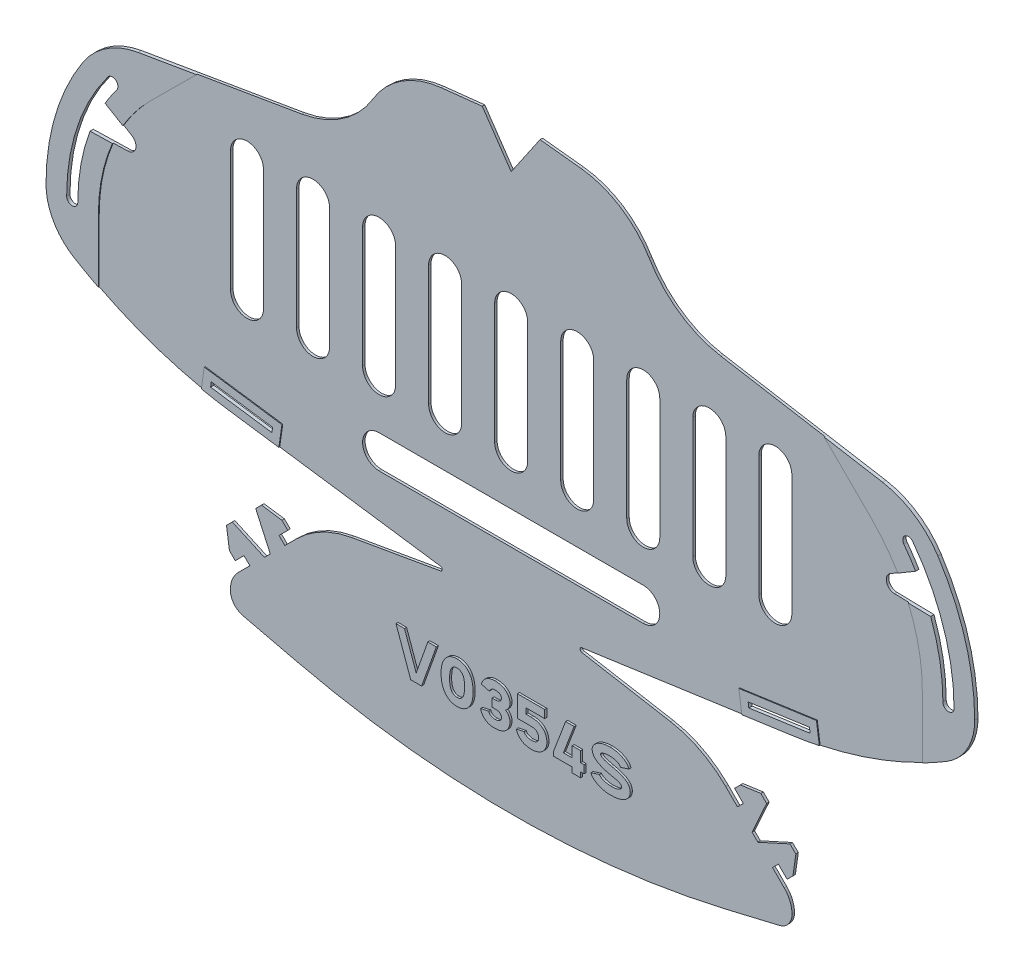
from build123d import *

# Parameters (mm, degrees)
MAIN_SHAPE_DEPTH                   = 0.6
ELASTIC_ATTACHMENT_POINTS_DEPTH    = 184.525502315
REINFORCED_ATTACHMENT_POINTS_DEPTH = 0.2
TAB_SLITS_DEPTH                    = 184.525502315
REINFORCED_TAB_SLITS_DEPTH         = 0.2
TAB_FLEX_RELIEF_DEPTH              = 184.525502315
TAB_FLEX_RELIEF_DEPTH_BACK         = 184.525502315
BREATHING_SLITS_DEPTH              = 184.525502315
VERSION_NUMBER_DEPTH               = 0.5
FILLET1_R                          = 0.5
CUT_EXTRUDE1_DEPTH                 = 184.526265229
CUT_EXTRUDE1_DEPTH_BACK            = 184.526265229


with BuildPart() as part:
    # Sketch1 → Main Shape (new body)
    with BuildSketch(Plane.XY):
        with BuildLine():
            Line((0, -10.235233266), (-7, 0))
            Line((-7, 0), (-16.941855461, -1.076805455))
            ThreePointArc((-16.941855461, -1.076805455), (-26.448172688, -4.42923559), (-33.461443341, -11.669600897))
            ThreePointArc((-33.461443341, -11.669600897), (-40.804108255, -19.481824954), (-50.74391922, -23.5))
            Line((-50.74391922, -23.5), (-90.180351554, -30.190874742))
            ThreePointArc((-90.180351554, -30.190874742), (-97.811505455, -33.190405434), (-103.597722286, -39))
            ThreePointArc((-103.597722286, -39), (-110.227482046, -53.35351039), (-112.5, -69))
            ThreePointArc((-112.5, -69), (-110.685143325, -75.893640703), (-105.711102551, -81))
            ThreePointArc((-105.711102551, -81), (-87.655491519, -89.524485559), (-68.266232563, -94.291935705))
            Line((-68.266232563, -94.291935705), (-14, -102))
            Line((-14, -102), (-38.626554922, -106.304973016))
            ThreePointArc((-38.626554922, -106.304973016), (-45.849449199, -108.748014338), (-52, -113.254607005))
            Line((-52, -113.254607005), (-54.828307349, -116.0831539))
            Line((-54.828307349, -116.0831539), (-56.242580797, -114.669000226))
            Line((-56.242580797, -114.669000226), (-54.121350285, -112.547590054))
            Line((-54.121350285, -112.547590054), (-55.535623732, -111.13343638))
            Line((-55.535623732, -111.13343638), (-60.48540114, -110.426539202))
            Line((-60.48540114, -110.426539202), (-68.970323187, -118.912179887))
            Line((-68.970323187, -118.912179887), (-68.263006804, -123.861897408))
            Line((-68.263006804, -123.861897408), (-66.848733357, -125.276051082))
            Line((-66.848733357, -125.276051082), (-64.727502845, -123.154640911))
            Line((-64.727502845, -123.154640911), (-63.313229397, -124.568794586))
            Line((-63.313229397, -124.568794586), (-66.141536747, -127.397341481))
            ThreePointArc((-66.141536747, -127.397341481), (-67.550417669, -129.506025763), (-68.045148042, -131.993340924))
            ThreePointArc((-68.045148042, -131.993340924), (-67.183295285, -134.473669911), (-64.9691321, -135.885159709))
            Line((-64.9691321, -135.885159709), (-52.436095294, -138.860716087))
            ThreePointArc((-52.436095294, -138.860716087), (-26.397134772, -143.459954927), (0, -145))
            ThreePointArc((0, -145), (26.397134772, -143.459954927), (52.436095294, -138.860716087))
            Line((52.436095294, -138.860716087), (64.9691321, -135.885159709))
            ThreePointArc((64.9691321, -135.885159709), (67.183295285, -134.473669911), (68.045148042, -131.993340924))
            ThreePointArc((68.045148042, -131.993340924), (67.550417669, -129.506025763), (66.141536747, -127.397341481))
            Line((66.141536747, -127.397341481), (63.313229397, -124.568794586))
            Line((63.313229397, -124.568794586), (64.727502845, -123.154640911))
            Line((64.727502845, -123.154640911), (66.848733357, -125.276051082))
            Line((66.848733357, -125.276051082), (68.263006804, -123.861897408))
            Line((68.263006804, -123.861897408), (68.970323187, -118.912179887))
            Line((68.970323187, -118.912179887), (60.48540114, -110.426539202))
            Line((60.48540114, -110.426539202), (55.535623732, -111.13343638))
            Line((55.535623732, -111.13343638), (54.121350285, -112.547590054))
            Line((54.121350285, -112.547590054), (56.242580797, -114.669000226))
            Line((56.242580797, -114.669000226), (54.828307349, -116.0831539))
            Line((54.828307349, -116.0831539), (52, -113.254607005))
            ThreePointArc((52, -113.254607005), (45.849449199, -108.748014338), (38.626554922, -106.304973016))
            Line((38.626554922, -106.304973016), (14, -102))
            Line((14, -102), (68.266232563, -94.291935705))
            ThreePointArc((68.266232563, -94.291935705), (87.655491519, -89.524485559), (105.711102551, -81))
            ThreePointArc((105.711102551, -81), (110.685143325, -75.893640703), (112.5, -69))
            ThreePointArc((112.5, -69), (110.227482046, -53.35351039), (103.597722286, -39))
            ThreePointArc((103.597722286, -39), (97.811505455, -33.190405434), (90.180351554, -30.190874742))
            Line((90.180351554, -30.190874742), (50.74391922, -23.5))
            ThreePointArc((50.74391922, -23.5), (40.804108255, -19.481824954), (33.461443341, -11.669600897))
            ThreePointArc((33.461443341, -11.669600897), (26.448172688, -4.42923559), (16.941855461, -1.076805455))
            Line((16.941855461, -1.076805455), (7, 0))
            Line((7, 0), (0, -10.235233266))
        make_face()
    extrude(amount=MAIN_SHAPE_DEPTH)

    # Sketch2 → Elastic Attachment Points (cut, through all)
    with BuildSketch(Plane.XY.offset(0.6)):
        with BuildLine():
            ThreePointArc((-97.5, -39), (-104.934164903, -53.188611699), (-107.5, -69))
            ThreePointArc((-107.5, -69), (-106.15, -70.35), (-104.8, -69))
            ThreePointArc((-104.8, -69), (-102.372719998, -54.042426667), (-95.34, -40.62))
            ThreePointArc((-95.34, -40.62), (-95.61, -38.73), (-97.5, -39))
        make_face()
        with BuildLine():
            ThreePointArc((97.5, -39), (104.934164903, -53.188611699), (107.5, -69))
            ThreePointArc((107.5, -69), (106.15, -70.35), (104.8, -69))
            ThreePointArc((104.8, -69), (102.372719998, -54.042426667), (95.34, -40.62))
            ThreePointArc((95.34, -40.62), (95.61, -38.73), (97.5, -39))
        make_face()
    extrude(amount=-ELASTIC_ATTACHMENT_POINTS_DEPTH, mode=Mode.SUBTRACT)

    # Sketch7 → Reinforced Attachment Points (add)
    # profile 1 of 2: a face of its own
    with BuildSketch(Plane.XY.offset(0.6)):
        with BuildLine():
            Line((-99.8, -69), (-99.8, -84.285345235))
            ThreePointArc((-99.8, -84.285345235), (-102.78333163, -82.692655957), (-105.711102551, -81))
            ThreePointArc((-105.711102551, -81), (-110.685143325, -75.893640703), (-112.5, -69))
            ThreePointArc((-112.5, -69), (-110.227482046, -53.35351039), (-103.597722286, -39))
            ThreePointArc((-103.597722286, -39), (-97.811505455, -33.190405434), (-90.180351554, -30.190874742))
            Line((-90.180351554, -30.190874742), (-76.046591346, -27.792908862))
            Line((-76.046591346, -27.792908862), (-87.320965779, -39))
            ThreePointArc((-87.320965779, -39), (-96.555837288, -52.754028999), (-99.8, -69))
        make_face()
        with BuildLine():
            ThreePointArc((-107.5, -69), (-106.15, -70.35), (-104.8, -69))
            ThreePointArc((-104.8, -69), (-102.372719998, -54.042426667), (-95.34, -40.62))
            ThreePointArc((-95.34, -40.62), (-95.61, -38.73), (-97.5, -39))
            ThreePointArc((-97.5, -39), (-104.934164903, -53.188611699), (-107.5, -69))
        make_face(mode=Mode.SUBTRACT)
    # profile 2 of 2: a face of its own
    with BuildSketch(Plane.XY.offset(0.6)):
        with BuildLine():
            Line((76.046591346, -27.792908862), (90.180351554, -30.190874742))
            ThreePointArc((90.180351554, -30.190874742), (97.811505455, -33.190405434), (103.597722286, -39))
            ThreePointArc((103.597722286, -39), (110.227482046, -53.35351039), (112.5, -69))
            ThreePointArc((112.5, -69), (110.685143325, -75.893640703), (105.711102551, -81))
            ThreePointArc((105.711102551, -81), (102.78333163, -82.692655957), (99.8, -84.285345235))
            Line((99.8, -84.285345235), (99.8, -69))
            ThreePointArc((99.8, -69), (96.555837288, -52.754028999), (87.320965779, -39))
            Line((87.320965779, -39), (76.046591346, -27.792908862))
        make_face()
        with BuildLine():
            ThreePointArc((104.8, -69), (106.15, -70.35), (107.5, -69))
            ThreePointArc((107.5, -69), (104.934164903, -53.188611699), (97.5, -39))
            ThreePointArc((97.5, -39), (95.61, -38.73), (95.34, -40.62))
            ThreePointArc((95.34, -40.62), (102.372719998, -54.042426667), (104.8, -69))
        make_face(mode=Mode.SUBTRACT)
    extrude(amount=REINFORCED_ATTACHMENT_POINTS_DEPTH)

    # Sketch6 → Tab Slits (cut, through all)
    with BuildSketch(Plane.XY.offset(0.6)):
        Polygon((-72.627441637, -91.652387373), (-57.776508424, -93.761838179), (-57.60775236, -92.573763522), (-72.458685573, -90.464312716), align=None)
        Polygon((72.627441637, -91.652387373), (72.458685573, -90.464312716), (57.60775236, -92.573763522), (57.776508424, -93.761838179), align=None)
    extrude(amount=-TAB_SLITS_DEPTH, mode=Mode.SUBTRACT)

    # Sketch9 → Reinforced Tab Slits (add)
    # profile 1 of 2: a face of its own
    with BuildSketch(Plane.XY.offset(0.6)):
        with BuildLine():
            Line((-56.077644103, -96.023222715), (-55.346367824, -90.874899201))
            Line((-55.346367824, -90.874899201), (-74.157549894, -88.20292818))
            Line((-74.157549894, -88.20292818), (-74.857329404, -93.129508476))
            ThreePointArc((-74.857329404, -93.129508476), (-71.571508598, -93.76587879), (-68.266232563, -94.291935705))
            Line((-68.266232563, -94.291935705), (-56.077644103, -96.023222715))
        make_face()
        Polygon((-57.776508424, -93.761838179), (-57.60775236, -92.573763522), (-72.458685573, -90.464312716), (-72.627441637, -91.652387373), align=None, mode=Mode.SUBTRACT)
    # profile 2 of 2: a face of its own
    with BuildSketch(Plane.XY.offset(0.6)):
        with BuildLine():
            Line((68.266232563, -94.291935705), (56.077644103, -96.023222715))
            Line((56.077644103, -96.023222715), (55.346367824, -90.874899201))
            Line((55.346367824, -90.874899201), (74.157549894, -88.20292818))
            Line((74.157549894, -88.20292818), (74.857329404, -93.129508476))
            ThreePointArc((74.857329404, -93.129508476), (71.571508598, -93.76587879), (68.266232563, -94.291935705))
        make_face()
        Polygon((57.60775236, -92.573763522), (72.458685573, -90.464312716), (72.627441637, -91.652387373), (57.776508424, -93.761838179), align=None, mode=Mode.SUBTRACT)
    extrude(amount=REINFORCED_TAB_SLITS_DEPTH)

    # Sketch11 → Tab Flex Relief (cut, two sides: drawn at the far end of the back side and taken through both)
    with BuildSketch(Plane.XY.offset(0.6).offset(-TAB_FLEX_RELIEF_DEPTH_BACK)):
        Polygon((-67.556169513, -117.49790644), (-59.777845211, -121.033110967), (-58.363691536, -119.618837519), (-61.899554814, -111.840812649), align=None)
        Polygon((61.899554814, -111.840812649), (67.556169513, -117.49790644), (59.777845211, -121.033110967), (58.363691536, -119.618837519), align=None)
    extrude(amount=TAB_FLEX_RELIEF_DEPTH + TAB_FLEX_RELIEF_DEPTH_BACK, mode=Mode.SUBTRACT)

    # Sketch3 → Breathing Slits (cut, through all)
    with BuildSketch(Plane.XY.offset(0.6)):
        with BuildLine():
            Line((4, -39.81), (4, -69))
            ThreePointArc((4, -69), (0, -73), (-4, -69))
            Line((-4, -69), (-4, -39.81))
            ThreePointArc((-4, -39.81), (0, -35.81), (4, -39.81))
        make_face()
        with BuildLine():
            Line((-12, -39.81), (-12, -69))
            ThreePointArc((-12, -69), (-16, -73), (-20, -69))
            Line((-20, -69), (-20, -39.81))
            ThreePointArc((-20, -39.81), (-16, -35.81), (-12, -39.81))
        make_face()
        with BuildLine():
            Line((-28, -39.81), (-28, -69))
            ThreePointArc((-28, -69), (-32, -73), (-36, -69))
            Line((-36, -69), (-36, -39.81))
            ThreePointArc((-36, -39.81), (-32, -35.81), (-28, -39.81))
        make_face()
        with BuildLine():
            Line((-32, -81), (32, -81))
            ThreePointArc((32, -81), (36, -85), (32, -89))
            Line((32, -89), (-32, -89))
            ThreePointArc((-32, -89), (-36, -85), (-32, -81))
        make_face()
        with BuildLine():
            Line((-44, -39.81), (-44, -69))
            ThreePointArc((-44, -69), (-48, -73), (-52, -69))
            Line((-52, -69), (-52, -39.81))
            ThreePointArc((-52, -39.81), (-48, -35.81), (-44, -39.81))
        make_face()
        with BuildLine():
            Line((-60, -39.81), (-60, -69))
            ThreePointArc((-60, -69), (-64, -73), (-68, -69))
            Line((-68, -69), (-68, -39.81))
            ThreePointArc((-68, -39.81), (-64, -35.81), (-60, -39.81))
        make_face()
        with BuildLine():
            Line((12, -39.81), (12, -69))
            ThreePointArc((12, -69), (16, -73), (20, -69))
            Line((20, -69), (20, -39.81))
            ThreePointArc((20, -39.81), (16, -35.81), (12, -39.81))
        make_face()
        with BuildLine():
            Line((28, -39.81), (28, -69))
            ThreePointArc((28, -69), (32, -73), (36, -69))
            Line((36, -69), (36, -39.81))
            ThreePointArc((36, -39.81), (32, -35.81), (28, -39.81))
        make_face()
        with BuildLine():
            Line((44, -39.81), (44, -69))
            ThreePointArc((44, -69), (48, -73), (52, -69))
            Line((52, -69), (52, -39.81))
            ThreePointArc((52, -39.81), (48, -35.81), (44, -39.81))
        make_face()
        with BuildLine():
            Line((60, -39.81), (60, -69))
            ThreePointArc((60, -69), (64, -73), (68, -69))
            Line((68, -69), (68, -39.81))
            ThreePointArc((68, -39.81), (64, -35.81), (60, -39.81))
        make_face()
    extrude(amount=-BREATHING_SLITS_DEPTH, mode=Mode.SUBTRACT)

    # Sketch8 → Version Number (add)
    # profile 1 of 6: a face of its own
    with BuildSketch(Plane.XY.offset(0.6)):
        Polygon((-23.832604493, -128.5), (-21.197683858, -128.5), (-17.626255287, -118.5), (-19.68974735, -118.5), (-22.515144176, -126.420634921), (-25.340541001, -118.5), (-27.404033065, -118.5), align=None)
    # profile 2 of 6: a face of its own
    with BuildSketch(Plane.XY.offset(0.6)):
        with BuildLine():
            add(Edge.make_bspline(
                [(-12.604080607, -118.5), (-12.748446571, -118.505695671), (-13.031201719, -118.51685121), (-13.44433672, -118.5745591), (-13.832179423, -118.680335178), (-14.199380999, -118.819656178), (-14.54165657, -119.003303471), (-14.865449745, -119.221085059), (-15.15846036, -119.487440084), (-15.433915413, -119.785519386), (-15.679778594, -120.12453761), (-15.893214303, -120.500892889), (-16.07517708, -120.912503383), (-16.224098244, -121.360169436), (-16.339647292, -121.844506854), (-16.427401231, -122.364485904), (-16.47895567, -122.921030718), (-16.4896124, -123.303893775), (-16.495090982, -123.500722112)],
                knots=[0, 0, 0, 0, 0.970159994, 1.900155169, 2.79438565, 3.665191596, 4.532301255, 5.397946305, 6.279238358, 7.185391655, 8.120220805, 9.085107467, 10.08639026, 11.138349125, 12.249459105, 13.427760297, 14.677622047, 16, 16, 16, 16], degree=3))
            add(Edge.make_bspline(
                [(-16.495090982, -123.500722112), (-16.489667591, -123.69832053), (-16.479158964, -124.081196856), (-16.427191895, -124.637697099), (-16.339746005, -125.156966907), (-16.223636148, -125.641884177), (-16.075693485, -126.090648826), (-15.89314686, -126.502814664), (-15.679836556, -126.879260377), (-15.433755376, -127.218032326), (-15.159363638, -127.51659595), (-14.863896092, -127.779877259), (-14.542544849, -128.000979952), (-14.199187545, -128.183632701), (-13.83263449, -128.324409639), (-13.443681411, -128.425104033), (-13.03190309, -128.488808035), (-12.749121717, -128.496221224), (-12.604977641, -128.5)],
                knots=[0, 0, 0, 0, 1.327400251, 2.57203543, 3.750234214, 4.861247624, 5.917991082, 6.919186852, 7.883989653, 8.818737555, 9.724812096, 10.602616666, 11.47109776, 12.338132057, 13.208862319, 14.101698703, 15.032365954, 16, 16, 16, 16], degree=3))
            add(Edge.make_bspline(
                [(-12.604977641, -128.5), (-12.460837973, -128.496210687), (-12.178065243, -128.488776824), (-11.766224829, -128.425221319), (-11.376802498, -128.323813307), (-11.00944102, -128.184839888), (-10.667051541, -128.000200623), (-10.346005134, -127.779984633), (-10.050606466, -127.516566079), (-9.776196666, -127.218040576), (-9.530116039, -126.879258594), (-9.316823297, -126.502813072), (-9.13420142, -126.090657611), (-8.986563682, -125.641847927), (-8.869250832, -125.157235462), (-8.786808686, -124.637275213), (-8.72915246, -124.081441513), (-8.721242092, -123.698369528), (-8.717160708, -123.500722112)],
                knots=[0, 0, 0, 0, 0.96765053, 1.898333634, 2.791185227, 3.666728435, 4.529238626, 5.397734515, 6.275554038, 7.181644014, 8.116407839, 9.081227075, 10.082439899, 11.139201358, 12.250233695, 13.427610983, 14.672766316, 16, 16, 16, 16], degree=3))
            add(Edge.make_bspline(
                [(-8.717160708, -123.500722112), (-8.721301538, -123.303845261), (-8.729358243, -122.920787111), (-8.786602221, -122.364907693), (-8.869350416, -121.844238468), (-8.986100052, -121.360205444), (-9.134718017, -120.912494629), (-9.316755834, -120.500894477), (-9.530174011, -120.124539393), (-9.776036606, -119.785511139), (-10.051509843, -119.487469991), (-10.344451051, -119.220977415), (-10.667935913, -119.004075275), (-11.009247561, -118.818455332), (-11.377258125, -118.680915067), (-11.765574757, -118.574534625), (-12.178423835, -118.516562336), (-12.460908666, -118.506550382), (-12.604977641, -118.501444225)],
                knots=[0, 0, 0, 0, 1.322391154, 2.572941942, 3.750582404, 4.861863084, 5.913983562, 6.915420183, 7.880455081, 8.815427849, 9.721720359, 10.603147806, 11.468925845, 12.331628829, 13.207367743, 14.101735605, 15.031873656, 16, 16, 16, 16], degree=3))
            Line((-12.604977641, -118.501444225), (-12.604080607, -118.5))
        make_face()
        with BuildLine():
            add(Edge.make_bspline(
                [(-12.604080607, -126.579365079), (-12.673400155, -126.580142247), (-12.809410481, -126.581667111), (-13.006863718, -126.549518886), (-13.193314813, -126.50001124), (-13.367492108, -126.424863461), (-13.531287469, -126.32888552), (-13.681903012, -126.207295998), (-13.820262035, -126.063513987), (-13.947577093, -125.896932623), (-14.061448396, -125.703005633), (-14.159979385, -125.478827118), (-14.2407168, -125.222713054), (-14.309893558, -124.937433189), (-14.361144923, -124.621763618), (-14.399648488, -124.276117752), (-14.425515152, -123.899148475), (-14.428874427, -123.63702081), (-14.430621151, -123.500722112)],
                knots=[0, 0, 0, 0, 0.820209436, 1.609314487, 2.362064528, 3.101854642, 3.850272983, 4.605479342, 5.3882482, 6.210255141, 7.084711649, 8.047345167, 9.106040688, 10.263495908, 11.523832392, 12.893430008, 14.384674726, 16, 16, 16, 16], degree=3))
            add(Edge.make_bspline(
                [(-14.430621151, -123.500722112), (-14.42886754, -123.364424703), (-14.425495021, -123.102299516), (-14.399719376, -122.725313211), (-14.360826402, -122.378974061), (-14.310530118, -122.063111109), (-14.240312695, -121.778059679), (-14.160009663, -121.522619394), (-14.061479503, -121.298401339), (-13.947444844, -121.104640769), (-13.82105454, -120.937923887), (-13.681092054, -120.796456824), (-13.531371302, -120.674830172), (-13.367531418, -120.578630118), (-13.192885398, -120.50465551), (-13.007517851, -120.450210023), (-12.809374142, -120.423926373), (-12.67393087, -120.422146526), (-12.604977641, -120.421240419)],
                knots=[0, 0, 0, 0, 1.616177311, 3.108208617, 4.478528655, 5.748482895, 6.897727805, 7.956981757, 8.920123036, 9.795040793, 10.617481319, 11.394165711, 12.149770419, 12.898583529, 13.63876386, 14.394368568, 15.182584207, 16, 16, 16, 16], degree=3))
            add(Edge.make_bspline(
                [(-12.604977641, -120.421240419), (-12.536026006, -120.422149219), (-12.400585862, -120.423934355), (-12.202419641, -120.450179948), (-12.017133054, -120.504762296), (-11.842799707, -120.577982734), (-11.680574372, -120.675595023), (-11.531104614, -120.796360516), (-11.391204367, -120.937948802), (-11.264840055, -121.104645093), (-11.150615318, -121.298351736), (-11.052830037, -121.523063414), (-10.968870179, -121.777554553), (-10.89968108, -122.063195246), (-10.849051401, -122.378948588), (-10.810259287, -122.725320897), (-10.784453623, -123.102297333), (-10.781085472, -123.364423957), (-10.779334132, -123.500722112)],
                knots=[0, 0, 0, 0, 0.817669415, 1.606129616, 2.361968767, 3.102378757, 3.843623451, 4.599462602, 5.376387978, 6.199083685, 7.074272906, 8.037713021, 9.100132017, 10.249733507, 11.520081779, 12.89082699, 14.383321233, 16, 16, 16, 16], degree=3))
            add(Edge.make_bspline(
                [(-10.779334132, -123.500722112), (-10.781078585, -123.637021556), (-10.784433493, -123.899150658), (-10.810330169, -124.276110066), (-10.848733119, -124.621789015), (-10.900316338, -124.937349474), (-10.968458203, -125.223220708), (-11.052859715, -125.478383327), (-11.15064657, -125.703055181), (-11.264707749, -125.896928348), (-11.391996891, -126.063488884), (-11.530292982, -126.207393621), (-11.680657071, -126.328120602), (-11.842838298, -126.425517476), (-12.016703548, -126.499891817), (-12.203072886, -126.549600883), (-12.400262515, -126.581404352), (-12.53596105, -126.580608552), (-12.604977641, -126.580203806)],
                knots=[0, 0, 0, 0, 1.616177474, 3.108208932, 4.478529109, 5.739530511, 6.897596372, 7.959685938, 8.922827315, 9.797745161, 10.620185771, 11.403367596, 12.15897238, 12.899987232, 13.640167639, 14.39331481, 15.182836171, 16, 16, 16, 16], degree=3))
            Line((-12.604977641, -126.580203806), (-12.604080607, -126.579365079))
        make_face(mode=Mode.SUBTRACT)
    # profile 3 of 6: a face of its own
    with BuildSketch(Plane.XY.offset(0.6)):
        with BuildLine():
            Line((-3.2814758, -124.404761905), (-3.186237705, -124.404761905))
            add(Edge.make_bspline(
                [(-3.186237705, -124.404761905), (-3.08596981, -124.411299477), (-2.895334608, -124.423729091), (-2.628668312, -124.486416557), (-2.395874223, -124.578961335), (-2.204186845, -124.709274647), (-2.050541544, -124.861365804), (-1.936214105, -125.032278467), (-1.866552861, -125.222537651), (-1.857677424, -125.355662585), (-1.853200393, -125.422814713)],
                knots=[0, 0, 0, 0, 1.293250512, 2.458803691, 3.516087315, 4.504014474, 5.424976382, 6.287022232, 7.135923681, 8, 8, 8, 8], degree=3))
            add(Edge.make_bspline(
                [(-1.853200393, -125.422814713), (-1.856489943, -125.504440638), (-1.862850929, -125.662280257), (-1.931998301, -125.887718235), (-2.050353158, -126.087113891), (-2.185268995, -126.23073656), (-2.31443365, -126.331172702), (-2.429322646, -126.395688771), (-2.558173546, -126.450185226), (-2.701201552, -126.49595932), (-2.857923011, -126.532200484), (-3.028881948, -126.560253509), (-3.21470567, -126.575366879), (-3.343544666, -126.5785552), (-3.410164292, -126.580203806)],
                knots=[0, 0, 0, 0, 1.334208421, 2.579951764, 3.816761299, 5.103436918, 5.78324123, 6.491044783, 7.25516555, 8.072210043, 8.94833879, 9.888551629, 10.908219533, 12, 12, 12, 12], degree=3))
            add(Edge.make_bspline(
                [(-3.410164292, -126.580203806), (-3.484557883, -126.579024673), (-3.635042476, -126.576639503), (-3.861689022, -126.537785365), (-4.08996398, -126.472292557), (-4.317061379, -126.384048723), (-4.53121798, -126.26078738), (-4.708540508, -126.088542309), (-4.849710264, -125.87591894), (-4.904279418, -125.712337396), (-4.932682087, -125.62719493)],
                knots=[0, 0, 0, 0, 0.920255672, 1.861508472, 2.836752399, 3.857684402, 4.873720033, 5.872631744, 6.892727297, 8, 8, 8, 8], degree=3))
            Line((-4.932682087, -125.62719493), (-6.916396435, -126.071428571))
            add(Edge.make_bspline(
                [(-6.916396435, -126.071428571), (-6.893561151, -126.160336196), (-6.848605006, -126.335369884), (-6.755596127, -126.586847228), (-6.644158689, -126.824009097), (-6.519002346, -127.050933458), (-6.370851259, -127.26169635), (-6.20668272, -127.459934114), (-6.02745119, -127.647890635), (-5.827118898, -127.819546753), (-5.60967192, -127.976110236), (-5.372525346, -128.112422888), (-5.117959848, -128.230322428), (-4.842422458, -128.322934743), (-4.550304843, -128.399729339), (-4.239036274, -128.45295857), (-3.910205295, -128.491934936), (-3.684323803, -128.497268097), (-3.56861637, -128.5)],
                knots=[0, 0, 0, 0, 0.97897001, 1.927311989, 2.855460552, 3.773345826, 4.68872018, 5.599601379, 6.518067916, 7.456260856, 8.41049365, 9.372940738, 10.370680865, 11.39871829, 12.470472684, 13.590411754, 14.765692276, 16, 16, 16, 16], degree=3))
            add(Edge.make_bspline(
                [(-3.56861637, -128.5), (-3.412346484, -128.494245394), (-3.109820434, -128.483104934), (-2.672011645, -128.435865678), (-2.266363263, -128.358387224), (-1.892588471, -128.252017359), (-1.547714777, -128.123277608), (-1.236729357, -127.961059217), (-0.954637921, -127.774497038), (-0.7069839, -127.55815064), (-0.492589187, -127.319870658), (-0.300831613, -127.071551477), (-0.143042321, -126.805353082), (-0.010511667, -126.527874631), (0.088115957, -126.234513517), (0.15957966, -125.928607165), (0.201252062, -125.607680152), (0.206369695, -125.38925418), (0.208973031, -125.278141077)],
                knots=[0, 0, 0, 0, 1.338573179, 2.591371041, 3.766159492, 4.869841347, 5.915366975, 6.911991706, 7.866279139, 8.804635322, 9.718527085, 10.607232931, 11.486170613, 12.362759498, 13.235296616, 14.130311397, 15.048891017, 16, 16, 16, 16], degree=3))
            add(Edge.make_bspline(
                [(0.208973031, -125.278141077), (0.203624604, -125.181448476), (0.193097844, -124.991138356), (0.137782259, -124.713321084), (0.045422371, -124.451246621), (-0.083769367, -124.20784025), (-0.234969073, -123.977552327), (-0.410100489, -123.764837772), (-0.604497535, -123.566155092), (-0.748922201, -123.449574998), (-0.822113681, -123.39049458)],
                knots=[0, 0, 0, 0, 1.042147361, 2.051151675, 3.039496243, 4.024119517, 5.012016893, 6.002285516, 6.987598979, 8, 8, 8, 8], degree=3))
            add(Edge.make_bspline(
                [(-0.822113681, -123.39049458), (-0.748932646, -123.325162044), (-0.60457189, -123.19628365), (-0.410299767, -122.981710509), (-0.236129062, -122.755542958), (-0.08277331, -122.515248899), (0.044428215, -122.261642739), (0.137252304, -121.993228321), (0.193160567, -121.711764564), (0.203645955, -121.519933272), (0.208973031, -121.42247384)],
                knots=[0, 0, 0, 0, 1.026734164, 2.025389794, 3.025877614, 4.013273499, 5.006315215, 5.989929209, 6.978788314, 8, 8, 8, 8], degree=3))
            add(Edge.make_bspline(
                [(0.208973031, -121.42247384), (0.204891166, -121.322020203), (0.196872186, -121.124675201), (0.149929489, -120.835115028), (0.074751474, -120.558271626), (-0.032690583, -120.294880847), (-0.166106179, -120.042407113), (-0.330918093, -119.803370965), (-0.521947271, -119.574583887), (-0.74277813, -119.361344215), (-0.989477288, -119.166999953), (-1.261285504, -118.995833154), (-1.555824194, -118.84746887), (-1.876600247, -118.730513446), (-2.218515864, -118.632405283), (-2.5843957, -118.562780212), (-2.973470855, -118.515976725), (-3.240858946, -118.506371293), (-3.378014595, -118.501444225)],
                knots=[0, 0, 0, 0, 0.933249724, 1.833404674, 2.71837752, 3.592513965, 4.4704886, 5.365912677, 6.284554944, 7.234984132, 8.212272519, 9.196674926, 10.214289296, 11.269589965, 12.363543901, 13.515449053, 14.72555956, 16, 16, 16, 16], degree=3))
            add(Edge.make_bspline(
                [(-3.378014595, -118.501444225), (-3.491406947, -118.504384419), (-3.712587706, -118.510119502), (-4.035371976, -118.546209564), (-4.341201281, -118.597359567), (-4.630020007, -118.671164203), (-4.901063564, -118.76520159), (-5.154785647, -118.877770477), (-5.391315181, -119.009217236), (-5.60891845, -119.161041577), (-5.809179026, -119.328960798), (-5.990576014, -119.510905494), (-6.155323007, -119.704452098), (-6.299857183, -119.91288512), (-6.429486659, -120.132286581), (-6.536021688, -120.36651166), (-6.630940646, -120.610059019), (-6.674344864, -120.780460499), (-6.696322609, -120.866743363)],
                knots=[0, 0, 0, 0, 1.229240767, 2.397731417, 3.51786287, 4.588673614, 5.625367482, 6.624717489, 7.594406979, 8.554388623, 9.496885304, 10.424058211, 11.336820069, 12.248524965, 13.170856983, 14.095351914, 15.035580601, 16, 16, 16, 16], degree=3))
            Line((-6.696322609, -120.866743363), (-4.789412308, -121.373015873))
            add(Edge.make_bspline(
                [(-4.789412308, -121.373015873), (-4.778114658, -121.326631527), (-4.753598482, -121.22597637), (-4.663097355, -121.081457089), (-4.541248681, -120.927147787), (-4.380035906, -120.771324055), (-4.182658133, -120.625559671), (-3.944568155, -120.514206488), (-3.671483768, -120.446844288), (-3.47865433, -120.430020784), (-3.378014595, -120.421240419)],
                knots=[0, 0, 0, 0, 0.626586808, 1.359708585, 2.222843852, 3.223153095, 4.308434095, 5.447412619, 6.667777482, 8, 8, 8, 8], degree=3))
            add(Edge.make_bspline(
                [(-3.378014595, -120.421240419), (-3.305981609, -120.423218633), (-3.16774612, -120.42701494), (-2.970342798, -120.449676308), (-2.79005117, -120.474391788), (-2.629001765, -120.515621967), (-2.483386758, -120.558109891), (-2.358777571, -120.618078056), (-2.248016237, -120.680273756), (-2.133112549, -120.780934624), (-2.018784558, -120.912654377), (-1.915790606, -121.077310889), (-1.855793591, -121.24921056), (-1.854054523, -121.365405566), (-1.853200393, -121.42247384)],
                knots=[0, 0, 0, 0, 1.26888152, 2.435057415, 3.499383416, 4.470882074, 5.362320585, 6.164854387, 6.902680001, 7.591682225, 8.843898063, 9.963361673, 10.999720905, 12, 12, 12, 12], degree=3))
            add(Edge.make_bspline(
                [(-1.853200393, -121.42247384), (-1.858271147, -121.49199044), (-1.868349345, -121.630155711), (-1.943628158, -121.827940252), (-2.065153471, -122.008163808), (-2.228480217, -122.171288708), (-2.435816126, -122.307565764), (-2.683353101, -122.408872593), (-2.970233435, -122.47003825), (-3.174088278, -122.480300003), (-3.281565504, -122.485710249)],
                knots=[0, 0, 0, 0, 0.842573162, 1.674626639, 2.532888499, 3.465967991, 4.458251597, 5.524776888, 6.695002246, 8, 8, 8, 8], degree=3))
            Line((-3.281565504, -122.485710249), (-4.138618657, -122.484126984))
            Line((-4.138618657, -122.484126984), (-4.138618657, -124.404761905))
            Line((-4.138618657, -124.404761905), (-3.2814758, -124.404761905))
        make_face()
    # profile 4 of 6: a face of its own
    with BuildSketch(Plane.XY.offset(0.6)):
        with BuildLine():
            Line((5.366236539, -121.753968254), (4.080522253, -121.753968254))
            Line((4.080522253, -121.753968254), (4.080522253, -120.420634921))
            Line((4.080522253, -120.420634921), (8.620204793, -120.420634921))
            Line((8.620204793, -120.420634921), (8.620204793, -118.5))
            Line((8.620204793, -118.5), (2.01703019, -118.5))
            Line((2.01703019, -118.5), (2.01703019, -123.674603175))
            Line((2.01703019, -123.674603175), (5.28687146, -123.674603175))
            add(Edge.make_bspline(
                [(5.28687146, -123.674603175), (5.360960809, -123.675602086), (5.504912844, -123.677542922), (5.71435947, -123.692704514), (5.909877517, -123.723042675), (6.091401035, -123.763288516), (6.258501355, -123.817251662), (6.413089295, -123.879484934), (6.55070767, -123.959553064), (6.678087611, -124.046197885), (6.786971001, -124.149968295), (6.883114048, -124.26484275), (6.966137644, -124.390602025), (7.032499994, -124.530129867), (7.085487911, -124.680251755), (7.124394318, -124.842608973), (7.149739306, -125.017132432), (7.155130405, -125.137973815), (7.157900402, -125.200063241)],
                knots=[0, 0, 0, 0, 1.291340122, 2.50901164, 3.656233385, 4.737231688, 5.745647761, 6.71445312, 7.634539433, 8.515488686, 9.393300537, 10.245701923, 11.122702301, 12.011797026, 12.93168986, 13.892747604, 14.917274139, 16, 16, 16, 16], degree=3))
            add(Edge.make_bspline(
                [(7.157900402, -125.200063241), (7.153688052, -125.300114528), (7.14560378, -125.492131264), (7.065338201, -125.765733398), (6.926196706, -126.004538024), (6.767586314, -126.17434082), (6.615830139, -126.290319351), (6.484099394, -126.365431401), (6.338663975, -126.430026061), (6.178317613, -126.482096845), (6.004524143, -126.52675039), (5.814347501, -126.55439299), (5.610647927, -126.576932347), (5.469348079, -126.5790915), (5.396556287, -126.580203806)],
                knots=[0, 0, 0, 0, 1.417186054, 2.719839454, 3.999831516, 5.306419273, 5.988605249, 6.704054952, 7.452945314, 8.243009127, 9.093975494, 9.995834141, 10.967537284, 12, 12, 12, 12], degree=3))
            add(Edge.make_bspline(
                [(5.396556287, -126.580203806), (5.287648259, -126.574841975), (5.076983951, -126.564470411), (4.772033735, -126.511605126), (4.490160726, -126.424404763), (4.235903487, -126.306180725), (4.014818092, -126.167710506), (3.84297428, -126.007163051), (3.711326814, -125.83604344), (3.67087374, -125.706158133), (3.651287019, -125.643269778)],
                knots=[0, 0, 0, 0, 1.239808568, 2.398201666, 3.511107812, 4.586578273, 5.581900341, 6.46310827, 7.255862013, 8, 8, 8, 8], degree=3))
            Line((3.651287019, -125.643269778), (1.731315904, -126.071428571))
            add(Edge.make_bspline(
                [(1.731315904, -126.071428571), (1.755385764, -126.160548359), (1.803016248, -126.336902466), (1.909090395, -126.587616399), (2.033649421, -126.825640703), (2.178153898, -127.052018478), (2.346933994, -127.263372267), (2.536768461, -127.462365132), (2.748253619, -127.648069148), (2.980261942, -127.81997371), (3.229432639, -127.975914274), (3.495680822, -128.111508549), (3.775180047, -128.229596507), (4.071741517, -128.322648571), (4.381439946, -128.399168227), (4.707064689, -128.452814481), (5.046589519, -128.491742739), (5.278559699, -128.49721594), (5.396556287, -128.5)],
                knots=[0, 0, 0, 0, 0.933358014, 1.846969395, 2.747978179, 3.65058438, 4.560476191, 5.481090533, 6.430749403, 7.405393302, 8.400725728, 9.402100456, 10.426556211, 11.46786461, 12.544569044, 13.652675183, 14.805983081, 16, 16, 16, 16], degree=3))
            add(Edge.make_bspline(
                [(5.396556287, -128.5), (5.53376265, -128.495504774), (5.80219759, -128.486710171), (6.193287593, -128.433418982), (6.56517222, -128.360336182), (6.914706315, -128.252803179), (7.246000147, -128.123435212), (7.553843956, -127.960769192), (7.843937541, -127.774871052), (8.109204433, -127.558743904), (8.348569717, -127.321416343), (8.561177645, -127.067668109), (8.736441803, -126.794179288), (8.889676891, -126.509027952), (9.002782919, -126.203081966), (9.088391885, -125.88344012), (9.142028955, -125.5470022), (9.152646735, -125.31737072), (9.158070839, -125.200063241)],
                knots=[0, 0, 0, 0, 1.17826532, 2.30519616, 3.385644728, 4.42967802, 5.441717964, 6.435616201, 7.414838536, 8.396397341, 9.367976222, 10.306520034, 11.232826888, 12.153236024, 13.081197769, 14.026829533, 14.992003824, 16, 16, 16, 16], degree=3))
            add(Edge.make_bspline(
                [(9.158070839, -125.200063241), (9.153929994, -125.073635127), (9.145821892, -124.826078875), (9.100298755, -124.463686468), (9.02222004, -124.120728156), (8.914237738, -123.797399283), (8.77588151, -123.493469509), (8.604899259, -123.211065096), (8.405886833, -122.946164208), (8.176507511, -122.703396477), (7.91821426, -122.484022512), (7.632381393, -122.292954639), (7.319279181, -122.131495081), (6.979778579, -121.998507068), (6.613932742, -121.892820854), (6.220996353, -121.818407366), (5.801910345, -121.769392953), (5.513047812, -121.760188975), (5.36440659, -121.755452845)],
                knots=[0, 0, 0, 0, 1.047845617, 2.051764646, 3.021184748, 3.957929711, 4.871890627, 5.782411277, 6.68821354, 7.612570783, 8.544147221, 9.490634628, 10.455228194, 11.457623096, 12.507540162, 13.606000757, 14.768109627, 16, 16, 16, 16], degree=3))
            Line((5.36440659, -121.755452845), (5.366236539, -121.753968254))
        make_face()
    # profile 5 of 6: a face of its own
    with BuildSketch(Plane.XY.offset(0.6)):
        Polygon((15.267917132, -128.5), (17.331409195, -128.5), (17.331409195, -127.246031746), (18.156806021, -127.246031746), (18.156806021, -125.325396825), (17.331409195, -125.325396825), (17.331409195, -122.785714286), (15.267917132, -122.785714286), (15.267917132, -125.325396825), (13.156806021, -125.325396825), (15.759980624, -118.5), (13.696488561, -118.5), (10.696488561, -126.388888889), (10.696488561, -127.246031746), (15.267917132, -127.246031746), align=None)
    # profile 6 of 6: a face of its own
    with BuildSketch(Plane.XY.offset(0.6)):
        with BuildLine():
            add(Edge.make_bspline(
                [(29.352426701, -125.531746032), (29.349539749, -125.436285182), (29.343853583, -125.248264664), (29.293921676, -124.971573191), (29.211684674, -124.706487636), (29.093300832, -124.453940642), (28.938933275, -124.214454259), (28.750047991, -123.987830994), (28.527066404, -123.772935761), (28.27013565, -123.570035613), (27.975303588, -123.378876225), (27.641998457, -123.197945262), (27.267708694, -123.029686218), (26.856922704, -122.866007919), (26.405908013, -122.715136729), (25.914749574, -122.576683253), (25.385422306, -122.442048846), (25.016634726, -122.366313826), (24.826455325, -122.327258171)],
                knots=[0, 0, 0, 0, 0.761030942, 1.498933149, 2.234785869, 2.969649761, 3.716667643, 4.501656281, 5.31785169, 6.182843945, 7.109303426, 8.117634967, 9.205209993, 10.38112034, 11.64403038, 12.997003453, 14.451390136, 16, 16, 16, 16], degree=3))
            add(Edge.make_bspline(
                [(24.826455325, -122.327258171), (24.720710914, -122.30555769), (24.514919375, -122.263325903), (24.217457032, -122.193679101), (23.939661366, -122.126464334), (23.683775053, -122.053760118), (23.446603637, -121.983655528), (23.230000201, -121.910448671), (23.033381281, -121.837446954), (22.857864319, -121.761475107), (22.70240747, -121.683760331), (22.565531082, -121.606491372), (22.450441932, -121.52614758), (22.35461911, -121.445158589), (22.277599783, -121.363937692), (22.223541522, -121.278672354), (22.185997641, -121.192692147), (22.179560565, -121.132708689), (22.176401728, -121.103273277)],
                knots=[0, 0, 0, 0, 1.70301331, 3.314271901, 4.819820312, 6.211652842, 7.510691048, 8.721335644, 9.818207508, 10.818842107, 11.737003788, 12.55938616, 13.296472535, 13.947505605, 14.537298364, 15.05322349, 15.535392622, 16, 16, 16, 16], degree=3))
            add(Edge.make_bspline(
                [(22.176401728, -121.103273277), (22.180157445, -121.073730175), (22.187653756, -121.014762936), (22.228202939, -120.933320131), (22.281392275, -120.85502718), (22.35617146, -120.785136217), (22.447939215, -120.719416618), (22.558978852, -120.661024774), (22.687642332, -120.605450636), (22.889176475, -120.54205361), (23.165284757, -120.471543352), (23.524499317, -120.416791975), (23.911644564, -120.378194754), (24.180293336, -120.374778885), (24.318949394, -120.373015873)],
                knots=[0, 0, 0, 0, 0.442404219, 0.883026937, 1.343578875, 1.853695657, 2.403394497, 3.028419639, 3.725998545, 4.497210486, 6.185586065, 7.98320576, 9.92683641, 12, 12, 12, 12], degree=3))
            add(Edge.make_bspline(
                [(24.318949394, -120.373015873), (24.497541374, -120.37729896), (24.837512274, -120.38545232), (25.320552442, -120.449603007), (25.753116798, -120.541532724), (26.075104131, -120.657530966), (26.302987542, -120.764382868), (26.451952883, -120.847850049), (26.581731842, -120.939830039), (26.698151417, -121.031429053), (26.79243018, -121.134653096), (26.871599626, -121.23996742), (26.933205138, -121.351062201), (26.958715611, -121.429640789), (26.971299399, -121.468401979)],
                knots=[0, 0, 0, 0, 2.116454478, 4.028920736, 5.76824916, 7.349955427, 8.072555538, 8.751313014, 9.370620762, 9.95742532, 10.503217928, 11.022328702, 11.517735004, 12, 12, 12, 12], degree=3))
            Line((26.971299399, -121.468401979), (29.034966384, -120.801587302))
            add(Edge.make_bspline(
                [(29.034966384, -120.801587302), (29.00815554, -120.723709964), (28.953776159, -120.565754422), (28.833180452, -120.341160489), (28.68950593, -120.121644367), (28.511720779, -119.913174822), (28.303829864, -119.714727676), (28.06890089, -119.51991866), (27.801528189, -119.338111599), (27.508399519, -119.163651092), (27.19179819, -119.004001168), (26.855026052, -118.864827802), (26.502551908, -118.740627556), (26.130017408, -118.644853053), (25.741969787, -118.562439083), (25.335813632, -118.507359035), (24.912958079, -118.466483143), (24.624470445, -118.457698188), (24.477401472, -118.453219679)],
                knots=[0, 0, 0, 0, 0.726103589, 1.472727363, 2.243106217, 3.039201532, 3.885168805, 4.778176173, 5.730487181, 6.736533093, 7.788322898, 8.857683223, 9.951973907, 11.084718459, 12.251095641, 13.452483767, 14.701294093, 16, 16, 16, 16], degree=3))
            add(Edge.make_bspline(
                [(24.477401472, -118.453219679), (24.315801191, -118.458420382), (24.000475414, -118.468568357), (23.5401636, -118.511672061), (23.10578695, -118.581550523), (22.695328177, -118.669148997), (22.311492513, -118.783931561), (21.953145275, -118.922594816), (21.619432336, -119.081942833), (21.314924143, -119.266301303), (21.039482598, -119.463936656), (20.799572365, -119.676395626), (20.593193238, -119.89660328), (20.423549708, -120.127529061), (20.290756687, -120.369247363), (20.193490897, -120.620779741), (20.132031164, -120.883067537), (20.120189024, -121.061622507), (20.114228304, -121.151497822)],
                knots=[0, 0, 0, 0, 1.377469995, 2.687815851, 3.935975333, 5.124495959, 6.261503082, 7.345570081, 8.395751581, 9.408063538, 10.37480451, 11.280450556, 12.134282462, 12.941818463, 13.715344344, 14.477233427, 15.233518248, 16, 16, 16, 16], degree=3))
            add(Edge.make_bspline(
                [(20.114228304, -121.151497822), (20.123077319, -121.251403731), (20.140634977, -121.449630736), (20.213160616, -121.738159073), (20.323939888, -122.013403807), (20.478810117, -122.270337272), (20.665043849, -122.517689843), (20.896986763, -122.744618604), (21.163088143, -122.960971045), (21.467175081, -123.157964072), (21.796529292, -123.342173451), (22.145584886, -123.514030242), (22.511835983, -123.672790245), (22.894758893, -123.817702921), (23.29571919, -123.944781076), (23.710926033, -124.063140325), (24.144083098, -124.164162133), (24.4396632, -124.2191172), (24.589925412, -124.247054365)],
                knots=[0, 0, 0, 0, 0.821760829, 1.630486029, 2.430435666, 3.246780216, 4.084509209, 4.963694347, 5.90126642, 6.89401515, 7.931513956, 8.995878504, 10.084293625, 11.205122729, 12.352962801, 13.533823192, 14.746285084, 16, 16, 16, 16], degree=3))
            add(Edge.make_bspline(
                [(24.589925412, -124.247054365), (24.716315146, -124.271104092), (24.95877668, -124.317240226), (25.305648218, -124.390568434), (25.621011031, -124.464331664), (25.906472013, -124.536473727), (26.159427095, -124.612600111), (26.382577421, -124.684901781), (26.573165119, -124.760879191), (26.736562722, -124.836201027), (26.873021621, -124.915482438), (26.99059666, -124.994146041), (27.089249014, -125.075656688), (27.168852487, -125.160851516), (27.228331172, -125.250010311), (27.267123955, -125.342038798), (27.290065499, -125.437002093), (27.288829226, -125.500769755), (27.288203555, -125.533042246)],
                knots=[0, 0, 0, 0, 1.946246532, 3.733609547, 5.36272598, 6.845647735, 8.18659192, 9.358372485, 10.392664873, 11.288799933, 12.077323831, 12.777487233, 13.426878789, 14.008750178, 14.535466235, 15.03874927, 15.513515881, 16, 16, 16, 16], degree=3))
            add(Edge.make_bspline(
                [(27.288203555, -125.533042246), (27.283004122, -125.572493894), (27.272621762, -125.651271957), (27.225937827, -125.763941753), (27.158812233, -125.870720239), (27.067246449, -125.969216515), (26.955329683, -126.063010343), (26.818291791, -126.145729121), (26.661707105, -126.227189486), (26.418004217, -126.325186148), (26.080355343, -126.425017755), (25.645768984, -126.515184705), (25.175973798, -126.567070193), (24.851841237, -126.575724531), (24.684078096, -126.580203806)],
                knots=[0, 0, 0, 0, 0.475442435, 0.949375666, 1.448598243, 1.981544609, 2.555163518, 3.194514629, 3.896631431, 4.670633754, 6.340509376, 8.112188439, 9.987763167, 12, 12, 12, 12], degree=3))
            add(Edge.make_bspline(
                [(24.684078096, -126.580203806), (24.503886433, -126.572109733), (24.155733829, -126.55647098), (23.655550075, -126.478725016), (23.195311288, -126.367563715), (22.845775212, -126.232821617), (22.5957561, -126.111220303), (22.430324203, -126.024811322), (22.288560273, -125.934962582), (22.166624788, -125.84775563), (22.062578553, -125.764139055), (21.985403776, -125.675742049), (21.923528702, -125.591210672), (21.90187074, -125.529855009), (21.891647268, -125.500892549)],
                knots=[0, 0, 0, 0, 2.085601758, 4.029640844, 5.846941631, 7.554298496, 8.350531238, 9.063771086, 9.712503312, 10.290104796, 10.799278939, 11.25089282, 11.646389813, 12, 12, 12, 12], degree=3))
            Line((21.891647268, -125.500892549), (19.828617177, -126.182539683))
            add(Edge.make_bspline(
                [(19.828617177, -126.182539683), (19.849828732, -126.250083277), (19.893344218, -126.388648899), (20.000638404, -126.587318737), (20.13896585, -126.782860437), (20.312917964, -126.97382342), (20.513767995, -127.16700955), (20.750361605, -127.354666847), (21.017912227, -127.541162459), (21.315944871, -127.722624618), (21.640372144, -127.895356572), (21.989678234, -128.04680973), (22.361315348, -128.174010907), (22.752432385, -128.285697947), (23.166156951, -128.372304614), (23.601259447, -128.434545788), (24.056196015, -128.482865479), (24.367049222, -128.494211837), (24.525626018, -128.5)],
                knots=[0, 0, 0, 0, 0.613647145, 1.25889657, 1.950557234, 2.689781449, 3.49852342, 4.368549862, 5.309092783, 6.329505786, 7.397075822, 8.498689681, 9.63188432, 10.806198376, 12.029180101, 13.299330945, 14.622296846, 16, 16, 16, 16], degree=3))
            add(Edge.make_bspline(
                [(24.525626018, -128.5), (24.710968763, -128.49588282), (25.072204381, -128.487858379), (25.59709721, -128.44283088), (26.09146867, -128.378639283), (26.552142822, -128.28387812), (26.981868105, -128.168216561), (27.377653125, -128.025055376), (27.74384578, -127.861357991), (28.073246051, -127.667121448), (28.370500874, -127.45825003), (28.627804037, -127.228634382), (28.847474973, -126.98510506), (29.029249432, -126.725786844), (29.170932583, -126.449993757), (29.272273141, -126.157856569), (29.336155443, -125.850371783), (29.345594758, -125.639749418), (29.350376979, -125.533042246)],
                knots=[0, 0, 0, 0, 1.415296561, 2.758432896, 4.020726015, 5.21979204, 6.347116342, 7.415802313, 8.430704446, 9.405143793, 10.331280344, 11.200655261, 12.032659138, 12.830429736, 13.612062863, 14.392164618, 15.185425696, 16, 16, 16, 16], degree=3))
            Line((29.350376979, -125.533042246), (29.352426701, -125.531746032))
        make_face()
    extrude(amount=VERSION_NUMBER_DEPTH)

    # Fillet1
    fillet1_edges = [part.edges().sort_by_distance(p)[0] for p in [
        (14, -102, 0.3),
        (-14, -102, 0.3),
    ]]
    fillet(fillet1_edges, radius=FILLET1_R)

    # Sketch12 → Cut-Extrude1 (cut, two sides: drawn at the far end of the back side and taken through both)
    with BuildSketch(Plane.XY.offset(0.8).offset(-CUT_EXTRUDE1_DEPTH_BACK)):
        with BuildLine():
            Line((-98.182869077, -44.8713), (-91.873075253, -48.613590691))
            ThreePointArc((-91.873075253, -48.613590691), (-90.958522115, -50.840325527), (-92.846883729, -52.333257504))
            Line((-92.846883729, -52.333257504), (-101.844457924, -52.542203931))
            ThreePointArc((-101.844457924, -52.542203931), (-100.186324227, -48.624335004), (-98.182869077, -44.8713))
        make_face()
        with BuildLine():
            Line((101.844457924, -52.542203931), (92.846883729, -52.333257504))
            ThreePointArc((92.846883729, -52.333257504), (90.958522115, -50.840325527), (91.873075253, -48.613590691))
            Line((91.873075253, -48.613590691), (98.182869077, -44.8713))
            ThreePointArc((98.182869077, -44.8713), (100.186324227, -48.624335004), (101.844457924, -52.542203931))
        make_face()
    extrude(amount=CUT_EXTRUDE1_DEPTH + CUT_EXTRUDE1_DEPTH_BACK, mode=Mode.SUBTRACT)


solid = part.part
